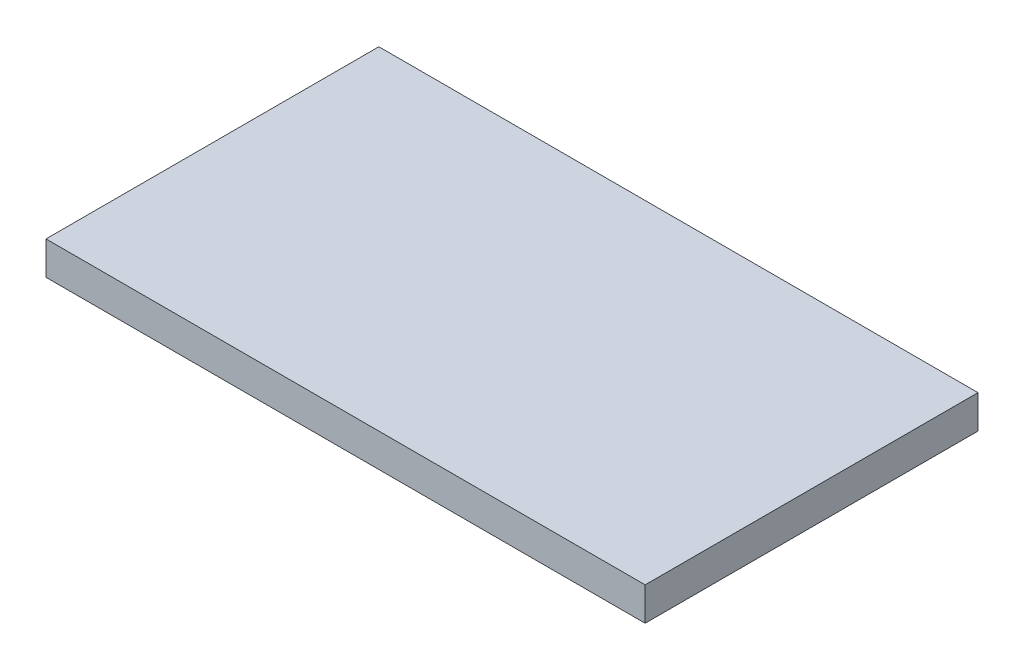
from build123d import *

# Parameters (mm, degrees)
BOSS_EXTRUDE1_DEPTH = 1.5875
SKETCH2_W           = 165.628666289
SKETCH2_H           = 57.268653068
SKETCH2_W_2         = 28.575
SKETCH2_H_2         = 15.875
CUT_EXTRUDE1_DEPTH  = 2.54


with BuildPart() as part:
    # Sketch1 → Boss-Extrude1 (new body)
    with BuildSketch(Plane(origin=(0, 0, 0), x_dir=(1, 0, 0), z_dir=(0, 1, 0))):
        with BuildLine():
            Line((-47.625, 7.9375), (47.625, 7.9375))
            ThreePointArc((47.625, 7.9375), (55.5625, 0), (47.625, -7.9375))
            Line((47.625, -7.9375), (-47.625, -7.9375))
            ThreePointArc((-47.625, -7.9375), (-55.5625, 0), (-47.625, 7.9375))
        make_face()
    extrude(amount=BOSS_EXTRUDE1_DEPTH)

    # Sketch2 → Cut-Extrude1 (cut)
    with BuildSketch(Plane(origin=(0, 1.5875, 0), x_dir=(1, 0, 0), z_dir=(0, 1, 0))):
        with Locations((0.064346802, 0.386080807)):
            Rectangle(SKETCH2_W, SKETCH2_H)
        Rectangle(SKETCH2_W_2, SKETCH2_H_2, mode=Mode.SUBTRACT)
    extrude(amount=-CUT_EXTRUDE1_DEPTH, mode=Mode.SUBTRACT)


solid = part.part
